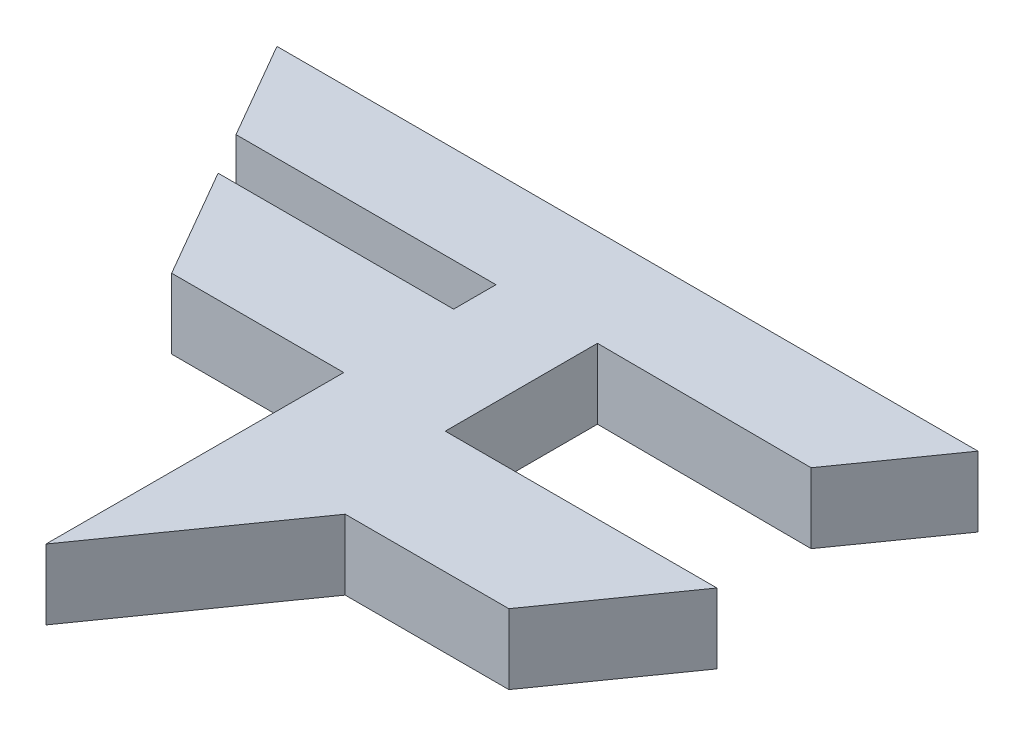
from build123d import *

# Parameters (mm, degrees)
EXTRUDE_3_DEPTH = 10


with BuildPart() as part:
    # 草图5 → 凸台-拉伸3 (new body)
    with BuildSketch(Plane(origin=(0, 0, 0), x_dir=(1, 0, 0), z_dir=(0, 1, 0))):
        Polygon((-56.641382098, 35.929183114), (-47.596473621, 20.262942082), (-23.047667144, 20.262942082), (-23.108683854, -22.151153959), (-5.453900892, 2.868012385), (17.896245496, 2.868012385), (30.17098336, 20.262942082), (-8.56989957, 20.262942082), (-8.56989957, 41.971791749), (22.043284645, 41.835167088), (31.891316146, 55.791132381), (-68.108683854, 55.791132381), (-60.13008382, 41.971791749), (-23.047667144, 41.971791749), (-23.047667144, 35.929183114), align=None)
    extrude(amount=EXTRUDE_3_DEPTH)


solid = part.part
